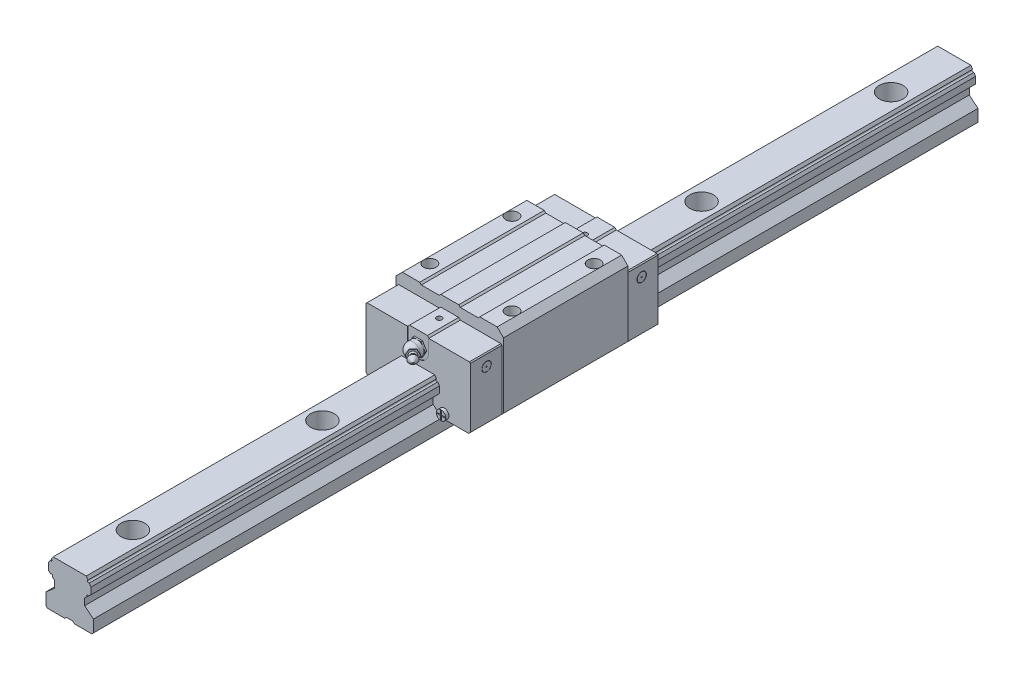
from build123d import *

# Parameters (mm, degrees)
SKETCH_1_R             = 1.5
EXTRUDE_11_DEPTH       = 29.7
SKETCH_1_12_R          = 1.5
EXTRUDE_12_DEPTH       = 30.7
EXTRUDE_13_DEPTH       = 19.7
EXTRUDE_14_DEPTH       = 140
CUT_EXTRUDE_1_DEPTH    = 0.5
SKETCH_6_R             = 2
CUT_EXTRUDE_3_DEPTH    = 5
SKETCH_7_R             = 0.836820084
CUT_EXTRUDE_4_DEPTH    = 8
CUT_EXTRUDE_6_DEPTH    = 0.1
SKETCH_11_R            = 3.75
SKETCH_11_R_2          = 2.25
CUT_EXTRUDE_7_DEPTH    = 5.3
SKETCH_12_R            = 2.25
CUT_EXTRUDE_8_DEPTH    = 15
PATTERN_LINEAR_1_COUNT = 5
PATTERN_LINEAR_1_PITCH = 60
SKETCH_13_R            = 1.5
SKETCH_13_R_2          = 1.4
SKETCH_13_R_3          = 0.2
CUT_EXTRUDE_9_DEPTH    = 5
EXTRUDE_16_DEPTH       = 0.5
EXTRUDE_17_DEPTH       = 0.230057146


with BuildPart() as part:
    # 草图1 → 凸台-拉伸11 (new, symmetric)
    with BuildSketch(Plane.XY):
        with BuildLine():
            Line((-16.5, 19.425), (-16.5, 0.5))
            Line((-16.5, 0.5), (-16, 0))
            Line((-16, 0), (-7.5, 0))
            Line((-7.5, 0), (-4.75, 2.307523986))
            Line((-4.75, 2.307523986), (-4.75, 4.418193206))
            Line((-4.75, 4.418193206), (-5.476477728, 5.099554443))
            ThreePointArc((-5.476477728, 5.099554443), (-5.493464298, 5.629612418), (-6.023522272, 5.612625848))
            Line((-6.023522272, 5.612625848), (-6.75, 6.293987085))
            Line((-6.75, 6.293987085), (-6.75, 8.404656305))
            Line((-6.75, 8.404656305), (-6.205141704, 9.238414341))
            ThreePointArc((-6.205141704, 9.238414341), (-5.686086188, 9.347186448), (-5.794858296, 9.866241964))
            Line((-5.794858296, 9.866241964), (-5.25, 10.7))
            Line((-5.25, 10.7), (5.25, 10.7))
            Line((5.25, 10.7), (5.794858296, 9.866241964))
            ThreePointArc((5.794858296, 9.866241964), (5.686086188, 9.347186448), (6.205141704, 9.238414341))
            Line((6.205141704, 9.238414341), (6.75, 8.404656305))
            Line((6.75, 8.404656305), (6.75, 6.293987085))
            Line((6.75, 6.293987085), (6.023522272, 5.612625848))
            ThreePointArc((6.023522272, 5.612625848), (5.493464298, 5.629612418), (5.476477728, 5.099554443))
            Line((5.476477728, 5.099554443), (4.75, 4.418193206))
            Line((4.75, 4.418193206), (4.75, 2.307523986))
            Line((4.75, 2.307523986), (7.5, 0))
            Line((7.5, 0), (16, 0))
            Line((16, 0), (16.5, 0.5))
            Line((16.5, 0.5), (16.5, 19.425))
            Line((16.5, 19.425), (16.2, 19.725))
            Line((16.2, 19.725), (3.333333333, 19.725))
            Line((3.333333333, 19.725), (2.833333333, 20.225))
            Line((2.833333333, 20.225), (-2.833333333, 20.225))
            Line((-2.833333333, 20.225), (-3.333333333, 19.725))
            Line((-3.333333333, 19.725), (-16.2, 19.725))
            Line((-16.2, 19.725), (-16.5, 19.425))
        make_face()
        with Locations((-8.237924758, 1.6)):
            Circle(SKETCH_1_R, mode=Mode.SUBTRACT)
        with Locations((8.237924758, 1.6)):
            Circle(SKETCH_1_R, mode=Mode.SUBTRACT)
    extrude(amount=EXTRUDE_11_DEPTH, both=True)

    # 草图1<12> → 凸台-拉伸12 (add, symmetric)
    with BuildSketch(Plane.XY):
        with Locations((8.237924758, 1.6)):
            Circle(SKETCH_1_12_R)
        with Locations(Location((-8.237924758, 1.6, 0), (0, 0, 180))):
            Circle(SKETCH_1_12_R)
    extrude(amount=EXTRUDE_12_DEPTH, both=True)

    # 草图1<13> → 凸台-拉伸13 (add, symmetric)
    with BuildSketch(Plane.XY):
        Polygon((-15, 23.7), (-17, 21.7), (-17, 17.7), (-16.75, 17.45), (-16.75, 0.75), (-16.5, 0.5), (-16.5, 19.425), (-16.2, 19.725), (-3.333333333, 19.725), (-2.833333333, 20.225), (2.833333333, 20.225), (3.333333333, 19.725), (16.2, 19.725), (16.5, 19.425), (16.5, 0.5), (17, 1), (17, 21.7), (15, 23.7), (9.5, 23.7), (9, 23.2), (3.333333333, 23.2), (2.833333333, 23.7), (-2.833333333, 23.7), (-3.333333333, 23.2), (-9, 23.2), (-9.5, 23.7), align=None)
    extrude(amount=EXTRUDE_13_DEPTH, both=True)

    # 草图1<14> → 凸台-拉伸14 (add, symmetric)
    with BuildSketch(Plane.XY):
        with BuildLine():
            Line((6.75, 8.404656305), (6.205141704, 9.238414341))
            ThreePointArc((6.205141704, 9.238414341), (5.686086188, 9.347186448), (5.794858296, 9.866241964))
            Line((5.794858296, 9.866241964), (5.25, 10.7))
            Line((5.25, 10.7), (-5.25, 10.7))
            Line((-5.25, 10.7), (-5.794858296, 9.866241964))
            ThreePointArc((-5.794858296, 9.866241964), (-5.686086188, 9.347186448), (-6.205141704, 9.238414341))
            Line((-6.205141704, 9.238414341), (-6.75, 8.404656305))
            Line((-6.75, 8.404656305), (-6.75, 6.293987085))
            Line((-6.75, 6.293987085), (-6.023522272, 5.612625848))
            ThreePointArc((-6.023522272, 5.612625848), (-5.493464298, 5.629612418), (-5.476477728, 5.099554443))
            Line((-5.476477728, 5.099554443), (-4.75, 4.418193206))
            Line((-4.75, 4.418193206), (-4.75, 2.307523986))
            Line((-4.75, 2.307523986), (-7.5, 0))
            Line((-7.5, 0), (-7.5, -3.8))
            Line((-7.5, -3.8), (-7, -4.3))
            Line((-7, -4.3), (-1.5, -4.3))
            Line((-1.5, -4.3), (-1, -3.8))
            Line((-1, -3.8), (1, -3.8))
            Line((1, -3.8), (1.5, -4.3))
            Line((1.5, -4.3), (7, -4.3))
            Line((7, -4.3), (7.5, -3.8))
            Line((7.5, -3.8), (7.5, 0))
            Line((7.5, 0), (4.75, 2.307523986))
            Line((4.75, 2.307523986), (4.75, 4.418193206))
            Line((4.75, 4.418193206), (5.476477728, 5.099554443))
            ThreePointArc((5.476477728, 5.099554443), (5.493464298, 5.629612418), (6.023522272, 5.612625848))
            Line((6.023522272, 5.612625848), (6.75, 6.293987085))
            Line((6.75, 6.293987085), (6.75, 8.404656305))
        make_face()
    extrude(amount=EXTRUDE_14_DEPTH, both=True)

    # 草图4 → 切除-拉伸1 (cut)
    with BuildSketch(Plane.XY.offset(30.7)):
        with BuildLine():
            Line((8.087924758, 1.75), (6.845983667, 1.75))
            ThreePointArc((6.845983667, 1.75), (6.837924758, 1.6), (6.845983667, 1.45))
            Line((6.845983667, 1.45), (8.087924758, 1.45))
            Line((8.087924758, 1.45), (8.087924758, 0.208058909))
            ThreePointArc((8.087924758, 0.208058909), (8.237924758, 0.2), (8.387924758, 0.208058909))
            Line((8.387924758, 0.208058909), (8.387924758, 1.45))
            Line((8.387924758, 1.45), (9.629865848, 1.45))
            ThreePointArc((9.629865848, 1.45), (9.637924758, 1.6), (9.629865848, 1.75))
            Line((9.629865848, 1.75), (8.387924758, 1.75))
            Line((8.387924758, 1.75), (8.387924758, 2.991941091))
            ThreePointArc((8.387924758, 2.991941091), (8.237924758, 3), (8.087924758, 2.991941091))
            Line((8.087924758, 2.991941091), (8.087924758, 1.75))
        make_face()
        with BuildLine():
            Line((-8.087924758, 2.991941091), (-8.087924758, 1.75))
            Line((-8.087924758, 1.75), (-6.845983667, 1.75))
            ThreePointArc((-6.845983667, 1.75), (-6.837924758, 1.6), (-6.845983667, 1.45))
            Line((-6.845983667, 1.45), (-8.087924758, 1.45))
            Line((-8.087924758, 1.45), (-8.087924758, 0.208058909))
            ThreePointArc((-8.087924758, 0.208058909), (-8.237924758, 0.2), (-8.387924758, 0.208058909))
            Line((-8.387924758, 0.208058909), (-8.387924758, 1.45))
            Line((-8.387924758, 1.45), (-9.629865848, 1.45))
            ThreePointArc((-9.629865848, 1.45), (-9.637924758, 1.6), (-9.629865848, 1.75))
            Line((-9.629865848, 1.75), (-8.387924758, 1.75))
            Line((-8.387924758, 1.75), (-8.387924758, 2.991941091))
            ThreePointArc((-8.387924758, 2.991941091), (-8.237924758, 3), (-8.087924758, 2.991941091))
        make_face()
    cut_extrude_1 = extrude(amount=-CUT_EXTRUDE_1_DEPTH, mode=Mode.SUBTRACT)

    # 镜向1: 切除-拉伸1 across plane
    add(cut_extrude_1.mirror(Plane.XY), mode=Mode.SUBTRACT)

    # 草图6 → 切除-拉伸3 (cut)
    with BuildSketch(Plane(origin=(0, 23.7, 0), x_dir=(1, 0, 0), z_dir=(0, 1, 0))):
        with Locations(Location((-13, 13, 0), (0, 0, 270))):
            Circle(SKETCH_6_R)
        with Locations(Location((-13, -13, 0), (0, 0, 180))):
            Circle(SKETCH_6_R)
        with Locations(Location((13, -13, 0), (0, 0, 270))):
            Circle(SKETCH_6_R)
        with Locations((13, 13)):
            Circle(SKETCH_6_R)
    extrude(amount=-CUT_EXTRUDE_3_DEPTH, mode=Mode.SUBTRACT)

    # 草图7 → 切除-拉伸4 (cut)
    with BuildSketch(Plane(origin=(0, 20.225, 0), x_dir=(1, 0, 0), z_dir=(0, 1, 0))):
        with Locations(Location((0, 23, 0), (0, 0, 270))):
            Circle(SKETCH_7_R)
        with Locations(Location((0, -23, 0), (0, 0, 90))):
            Circle(SKETCH_7_R)
    extrude(amount=-CUT_EXTRUDE_4_DEPTH, mode=Mode.SUBTRACT)

    # 草图8 → 切除-拉伸6 (cut)
    with BuildSketch(Plane.XY.offset(29.7)):
        with BuildLine():
            Line((-3.333333333, 19.725), (-3.333333333, 15.75))
            ThreePointArc((-3.333333333, 15.75), (0, 12.416666667), (3.333333333, 15.75))
            Line((3.333333333, 15.75), (3.333333333, 19.725))
            Line((3.333333333, 19.725), (2.833333333, 20.225))
            Line((2.833333333, 20.225), (-2.833333333, 20.225))
            Line((-2.833333333, 20.225), (-3.333333333, 19.725))
        make_face()
    extrude(amount=-CUT_EXTRUDE_6_DEPTH, mode=Mode.SUBTRACT)

    # 草图9 → 旋转1 (revolve)
    with BuildSketch(Plane(origin=(0, 15.75, 0), x_dir=(-1, 0, 0), z_dir=(0, 1, 0))):
        with BuildLine():
            Line((0, 29.6), (0, 33.6))
            ThreePointArc((0, 33.6), (-1.590990258, 32.940990258), (-2.25, 31.35))
            Line((-2.25, 31.35), (-2.25, 29.6))
            Line((-2.25, 29.6), (0, 29.6))
        make_face()
    revolve(axis=Axis((0, 15.75, 29.6), (0, 0, 1)))

    # 草图11 → 切除-拉伸7 (cut)
    with BuildSketch(Plane(origin=(0, 10.7, 0), x_dir=(1, 0, 0), z_dir=(0, 1, 0))):
        with Locations(Location((0, -120, 0), (0, 0, 270))):
            Circle(SKETCH_11_R)
        with Locations(Location((0, -120, 0), (0, 0, 270))):
            Circle(SKETCH_11_R_2, mode=Mode.SUBTRACT)
    cut_extrude_7 = extrude(amount=-CUT_EXTRUDE_7_DEPTH, mode=Mode.SUBTRACT)

    # 草图12 → 切除-拉伸8 (cut)
    with BuildSketch(Plane(origin=(0, 10.7, 0), x_dir=(1, 0, 0), z_dir=(0, 1, 0))):
        with Locations(Location((0, -120, 0), (0, 0, 270))):
            Circle(SKETCH_12_R)
    cut_extrude_8 = extrude(amount=-CUT_EXTRUDE_8_DEPTH, mode=Mode.SUBTRACT)

    # 阵列(线性)1: 切除-拉伸7, 切除-拉伸8 ×5
    with Locations(*[(0, 0, -i * PATTERN_LINEAR_1_PITCH) for i in range(1, PATTERN_LINEAR_1_COUNT)]):
        add(cut_extrude_7, mode=Mode.SUBTRACT)
        add(cut_extrude_8, mode=Mode.SUBTRACT)

    # 草图13 → 切除-拉伸9 (cut)
    # profile 1 of 4: a face of its own
    with BuildSketch(Plane(origin=(16.5, 0, 0), x_dir=(0, 0, -1), z_dir=(1, 0, 0))):
        with Locations(Location((-24.55, 16, 0), (0, 0, 90))):
            Circle(SKETCH_13_R)
        with Locations(Location((-24.55, 16, 0), (0, 0, 90))):
            Circle(SKETCH_13_R_2, mode=Mode.SUBTRACT)
    # profile 2 of 4: a face of its own
    with BuildSketch(Plane(origin=(16.5, 0, 0), x_dir=(0, 0, -1), z_dir=(1, 0, 0))):
        with Locations(Location((-24.55, 16, 0), (0, 0, 90))):
            Circle(SKETCH_13_R_3)
    # profile 3 of 4: a face of its own
    with BuildSketch(Plane(origin=(16.5, 0, 0), x_dir=(0, 0, -1), z_dir=(1, 0, 0))):
        with Locations(Location((24.55, 16, 0), (0, 0, 90))):
            Circle(SKETCH_13_R)
        with Locations(Location((24.55, 16, 0), (0, 0, 90))):
            Circle(SKETCH_13_R_2, mode=Mode.SUBTRACT)
    # profile 4 of 4: a face of its own
    with BuildSketch(Plane(origin=(16.5, 0, 0), x_dir=(0, 0, -1), z_dir=(1, 0, 0))):
        with Locations(Location((24.55, 16, 0), (0, 0, 90))):
            Circle(SKETCH_13_R_3)
    extrude(amount=-CUT_EXTRUDE_9_DEPTH, mode=Mode.SUBTRACT)


with BuildPart() as body_2:
    # 草图10 → 旋转2 (revolve)
    with BuildSketch(Plane(origin=(0, 15.75, 0), x_dir=(-1, 0, 0), z_dir=(0, 1, 0))):
        Polygon((-1.175847749, 33.581482722), (-1.692145815, 35), (-3.454789905, 35), (-3.552394887, 34.902395021), (-1.290990258, 32.640990306), (-0.230330066, 33.701650458), (-0.393005031, 33.864325429), (-0.675847749, 33.581482722), align=None)
    revolve(axis=Axis((1.290990258, 15.75, 32.640990306), (0.7071067679037245, 0, 0.7071067944693703)))

    # Combine 1: union part
    add(part.part)

    # 草图14 → 凸台-拉伸16 (add)
    with BuildSketch(Plane.XY.offset(29.6)):
        Polygon((2.598076211, 15.75), (1.299038106, 18), (-1.299038106, 18), (-2.598076211, 15.75), (-1.299038106, 13.5), (1.299038106, 13.5), align=None)
    extrude(amount=EXTRUDE_16_DEPTH)

    # 草图15 → 凸台-拉伸17 (add)
    with BuildSketch(Plane(origin=(17.128665223, 0, 17.128665866), x_dir=(0.7071067944693696, 0, -0.7071067679037253), z_dir=(0.7071067679037253, 0, 0.7071067944693696))):
        Polygon((-20.435746366, 15.75), (-21.30177177, 17.25), (-23.033822578, 17.25), (-23.899847981, 15.75), (-23.033822578, 14.25), (-21.30177177, 14.25), align=None)
    extrude(amount=-EXTRUDE_17_DEPTH)


solid = body_2.part
